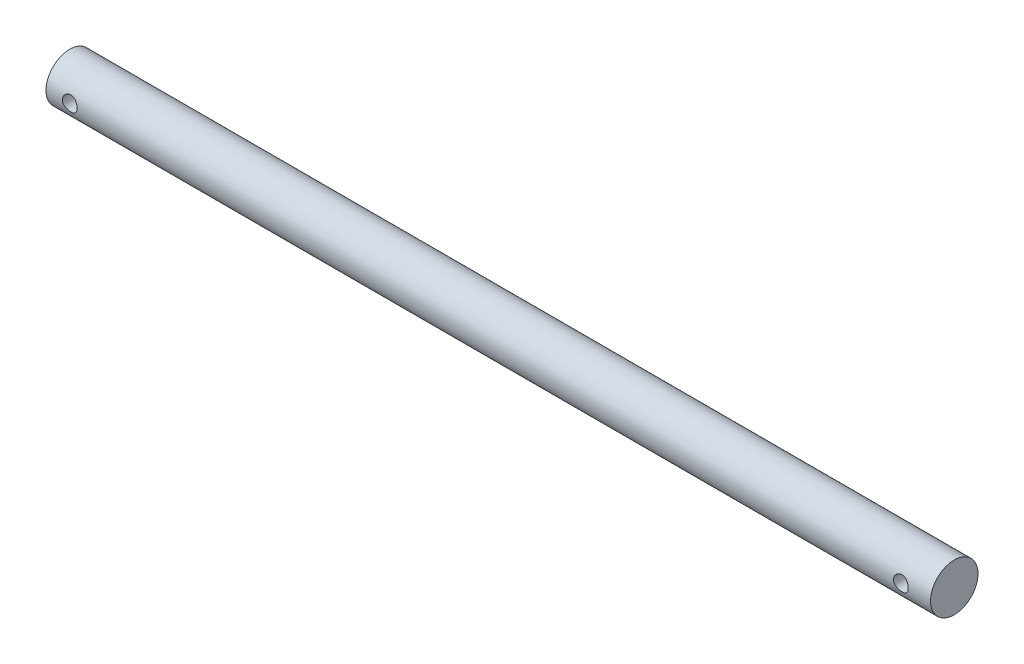
from build123d import *

# Parameters (mm, degrees)
SKETCH1_R           = 4
BOSS_EXTRUDE1_DEPTH = 74.5
M3_TAPPED_HOLE1_D   = 2.5


with BuildPart() as part:
    # Sketch1 → Boss-Extrude1 (new, symmetric)
    with BuildSketch(Plane(origin=(0, 0, 0), x_dir=(0, 0, -1), z_dir=(1, 0, 0))):
        Circle(SKETCH1_R)
    extrude(amount=BOSS_EXTRUDE1_DEPTH, both=True)

    # M3 Tapped Hole1 (through all)
    with Locations(Plane.XY.offset(4)):
        with Locations((-70.5, 0), (69.5, 0)):
            Hole(M3_TAPPED_HOLE1_D / 2)


solid = part.part
